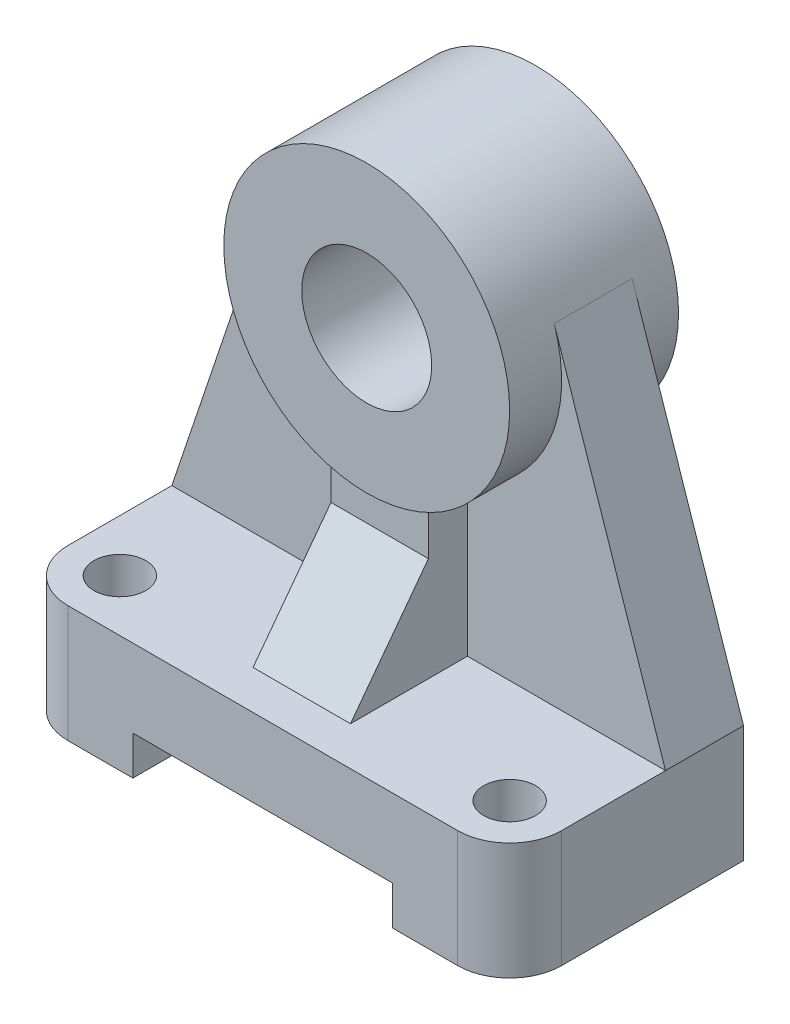
from build123d import *

# Parameters (mm, degrees)
SKETCH_1_R           = 2
EXTRUDE_1_DEPTH      = 9
EXTRUDE_2_DEPTH      = 6
EXTRUDE_4_DEPTH      = 3
EXTRUDE_4_DEPTH_BACK = 10
SKETCH_3_5_R         = 11
SKETCH_3_5_R_2       = 5
SKETCH_6_W           = 3
SKETCH_6_H           = 3
EXTRUDE_14_DEPTH     = 3.75
SKETCH_7_W           = 20
SKETCH_7_H           = 3
CUT_EXTRUDE_1_DEPTH  = 18
SKETCH_8_W           = 7.5
SKETCH_8_H           = 3
EXTRUDE_17_DEPTH     = 4


with BuildPart() as part:
    # 草图1 → 凸台-拉伸1 (new body)
    with BuildSketch(Plane(origin=(0, 0, 0), x_dir=(1, 0, 0), z_dir=(0, 1, 0))):
        with BuildLine():
            Line((0, 0), (38, 0))
            Line((38, 0), (38, -14))
            ThreePointArc((38, -14), (36.828427125, -16.828427125), (34, -18))
            Line((34, -18), (4, -18))
            ThreePointArc((4, -18), (1.171572875, -16.828427125), (0, -14))
            Line((0, -14), (0, 0))
        make_face()
        with Locations(Location((4, -14, 0), (0, 0, 270))):
            Circle(SKETCH_1_R, mode=Mode.SUBTRACT)
        with Locations(Location((34, -14, 0), (0, 0, 270))):
            Circle(SKETCH_1_R, mode=Mode.SUBTRACT)
    extrude(amount=EXTRUDE_1_DEPTH)

    # 草图3 → 凸台-拉伸2 (add)
    with BuildSketch(Plane(origin=(0, 0, 0), x_dir=(-1, 0, 0), z_dir=(0, 0, -1))):
        with BuildLine():
            Line((-38, 9), (-22.5, 9))
            Line((-22.5, 9), (-19, 9))
            Line((-19, 9), (-15.5, 9))
            Line((-15.5, 9), (0, 9))
            Line((0, 9), (-8.57330883, 34.504869647))
            ThreePointArc((-8.57330883, 34.504869647), (-8.144273335, 32.7757248), (-8, 31))
            ThreePointArc((-8, 31), (-20.7757248, 20.144273335), (-29.42669117, 34.504869647))
            Line((-29.42669117, 34.504869647), (-38, 9))
        make_face()
    extrude(amount=-EXTRUDE_2_DEPTH)

    # 草图3<5> → 凸台-拉伸4 (add, two sides: drawn at the far end of the back side and taken through both)
    with BuildSketch(Plane(origin=(0, 0, 0), x_dir=(-1, 0, 0), z_dir=(0, 0, -1)).offset(-EXTRUDE_4_DEPTH_BACK)):
        with Locations((-19, 31)):
            Circle(SKETCH_3_5_R)
        with Locations((-19, 31)):
            Circle(SKETCH_3_5_R_2, mode=Mode.SUBTRACT)
    extrude(amount=EXTRUDE_4_DEPTH + EXTRUDE_4_DEPTH_BACK)

    # 草图7 → 切除-拉伸1 (cut)
    with BuildSketch(Plane(origin=(0, 0, 0), x_dir=(-1, 0, 0), z_dir=(0, 0, -1))):
        with Locations((-19, 1.5)):
            Rectangle(SKETCH_7_W, SKETCH_7_H)
    extrude(amount=-CUT_EXTRUDE_1_DEPTH, mode=Mode.SUBTRACT)


with BuildPart() as body_2:
    # 草图6 → 凸台-拉伸14 (new, symmetric)
    with BuildSketch(Plane(origin=(19, 0, 0), x_dir=(0, 0, -1), z_dir=(1, 0, 0))):
        with Locations((-7.5, 18.5)):
            Rectangle(SKETCH_6_W, SKETCH_6_H)
        Polygon((-15, 9), (-6, 9), (-6, 17), (-9, 17), align=None)
    extrude(amount=EXTRUDE_14_DEPTH, both=True)


with BuildPart() as body_3:
    # 草图8 → 凸台-拉伸17 (new body)
    with BuildSketch(Plane(origin=(0, 20, 0), x_dir=(1, 0, 0), z_dir=(0, 1, 0))):
        with Locations((19, -7.5)):
            Rectangle(SKETCH_8_W, SKETCH_8_H)
    extrude(amount=EXTRUDE_17_DEPTH)


solid = Compound([part.part, body_2.part, body_3.part])
